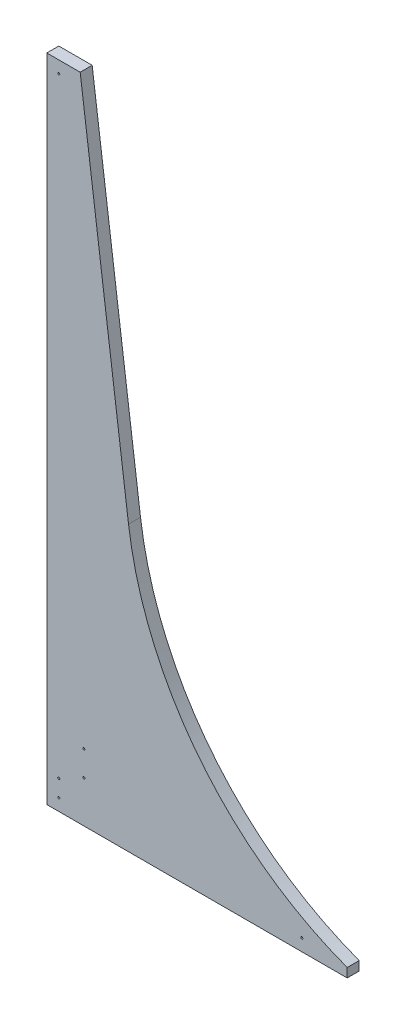
from build123d import *

# Parameters (mm, degrees)
SKETCH1_R           = 1.5875
BOSS_EXTRUDE1_DEPTH = 18.25625


with BuildPart() as part:
    # Sketch1 → Boss-Extrude1 (new body)
    with BuildSketch(Plane.XY):
        with BuildLine():
            Line((0, 990.6), (0, 0))
            Line((0, 0), (457.201, 0))
            Line((457.201, 0), (457.201, 13.862038208))
            ThreePointArc((457.201, 13.862038208), (232.767577124, 176.628269142), (124.367415652, 431.8))
            Line((124.367415652, 431.8), (50.8, 990.6))
            Line((50.8, 990.6), (0, 990.6))
        make_face()
        with Locations((18.25625, 18.25625)):
            Circle(SKETCH1_R, mode=Mode.SUBTRACT)
        with Locations((18.25625, 43.65625)):
            Circle(SKETCH1_R, mode=Mode.SUBTRACT)
        with Locations((56.35625, 63.5)):
            Circle(SKETCH1_R, mode=Mode.SUBTRACT)
        with Locations((56.35625, 101.6)):
            Circle(SKETCH1_R, mode=Mode.SUBTRACT)
        with Locations((388.14375, 18.25625)):
            Circle(SKETCH1_R, mode=Mode.SUBTRACT)
        with Locations((18.25625, 972.34375)):
            Circle(SKETCH1_R, mode=Mode.SUBTRACT)
    extrude(amount=BOSS_EXTRUDE1_DEPTH)


solid = part.part
